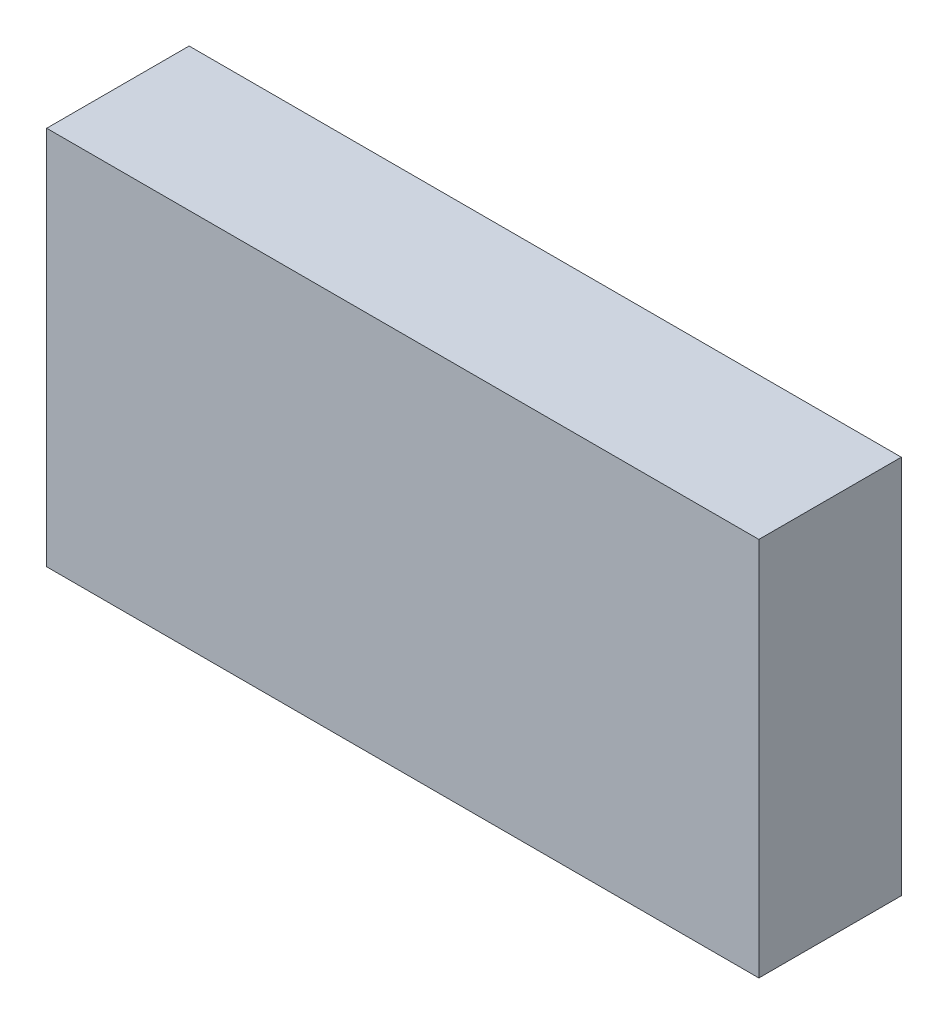
from build123d import *

# Parameters (mm, degrees)
SKETCH1_W                      = 15
SKETCH1_H                      = 8
CEK_1L_MIKNATIS_15X8X3_1_DEPTH = 3


with BuildPart() as part:
    # Sketch1 → CEK_1L_miknatis_15x8x3_1 (new body)
    with BuildSketch(Plane.XY):
        with Locations((603.5, 294)):
            Rectangle(SKETCH1_W, SKETCH1_H)
    extrude(amount=-CEK_1L_MIKNATIS_15X8X3_1_DEPTH)


solid = part.part
